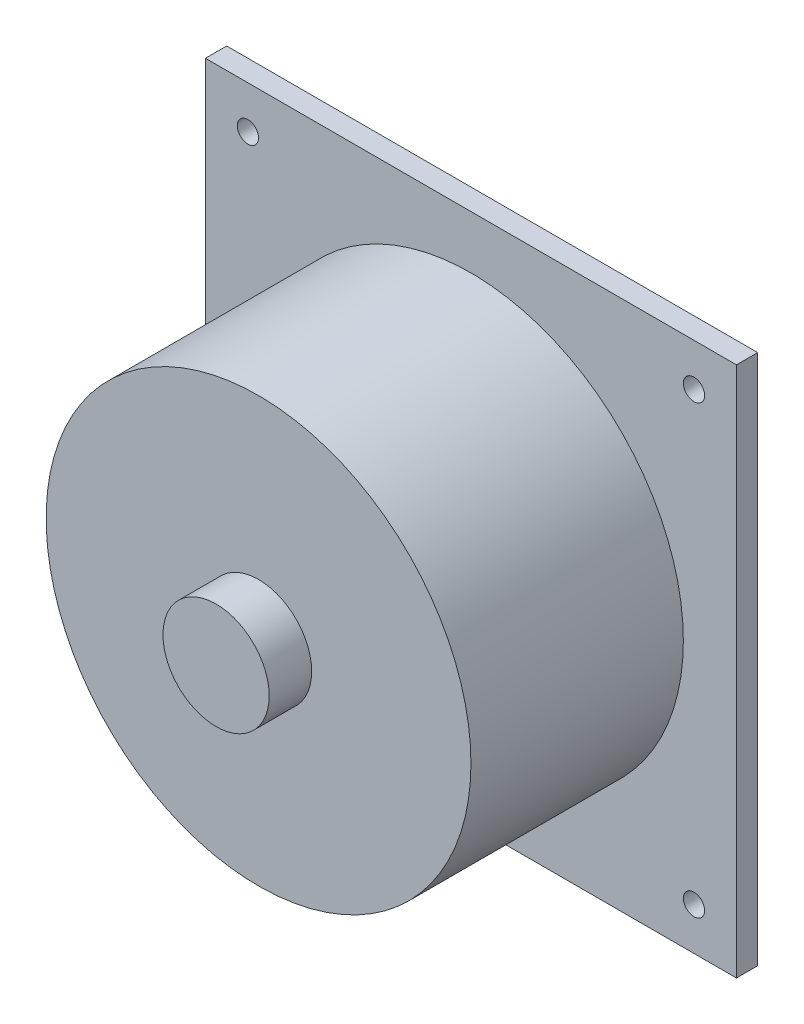
from build123d import *

# Parameters (mm, degrees)
SKETCH2_W           = 1250
SKETCH2_H           = 1250
BOSS_EXTRUDE1_DEPTH = 50
SKETCH3_R           = 500
BOSS_EXTRUDE2_DEPTH = 500
SKETCH4_R           = 25
CUT_EXTRUDE1_DEPTH  = 1016.504800579
SKETCH5_R           = 125
BOSS_EXTRUDE3_DEPTH = 100


with BuildPart() as part:
    # Sketch2 → Boss-Extrude1 (new body)
    with BuildSketch(Plane.XY):
        Rectangle(SKETCH2_W, SKETCH2_H)
    extrude(amount=BOSS_EXTRUDE1_DEPTH)

    # Sketch3 → Boss-Extrude2 (add)
    with BuildSketch(Plane.XY.offset(50)):
        Circle(SKETCH3_R)
    extrude(amount=BOSS_EXTRUDE2_DEPTH)

    # Sketch4 → Cut-Extrude1 (cut, through all)
    with BuildSketch(Plane.XY.offset(50)):
        with Locations((-525, 525)):
            Circle(SKETCH4_R)
        with Locations((-525, -525)):
            Circle(SKETCH4_R)
        with Locations((525, -525)):
            Circle(SKETCH4_R)
        with Locations((525, 525)):
            Circle(SKETCH4_R)
    extrude(amount=-CUT_EXTRUDE1_DEPTH, mode=Mode.SUBTRACT)

    # Sketch5 → Boss-Extrude3 (add)
    with BuildSketch(Plane.XY.offset(550)):
        Circle(SKETCH5_R)
    extrude(amount=BOSS_EXTRUDE3_DEPTH)


solid = part.part
